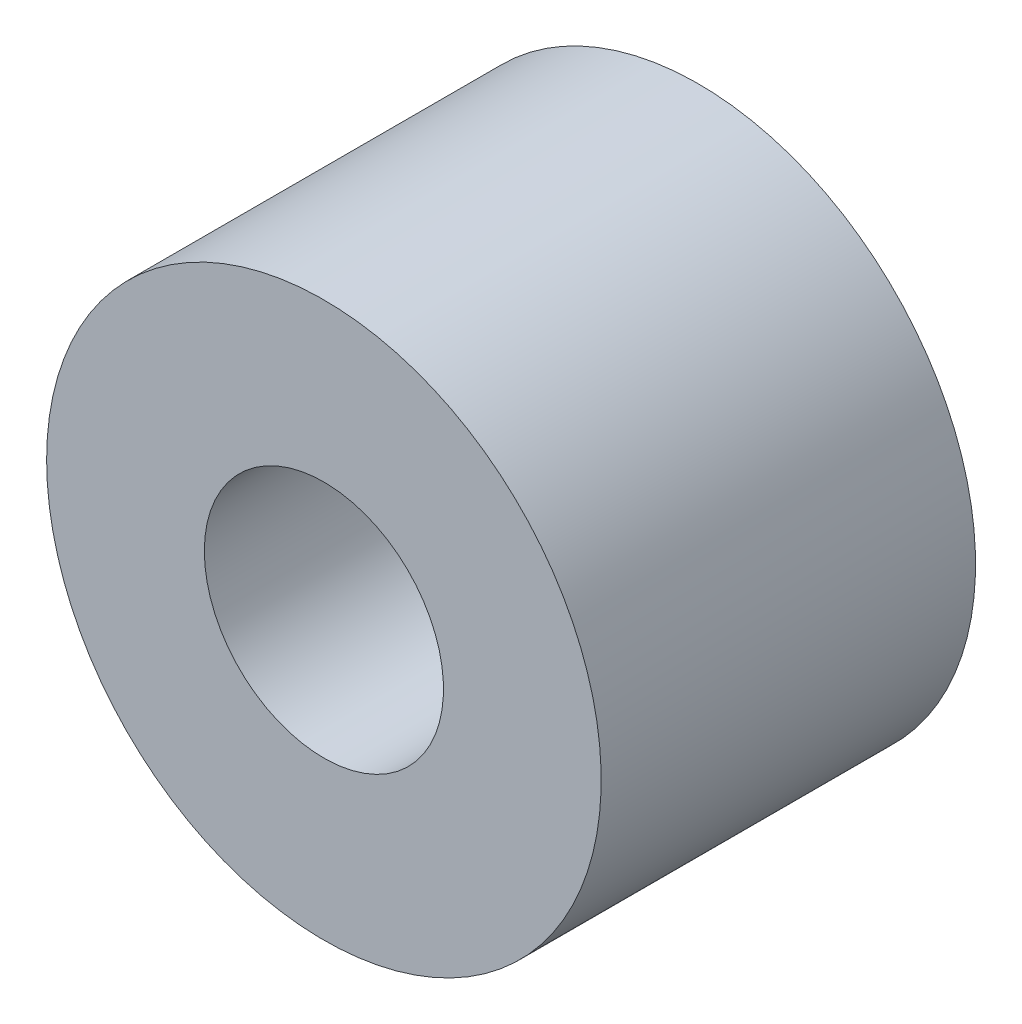
from build123d import *

# Parameters (mm, degrees)
SKETCH1_R           = 4
SKETCH1_R_2         = 1.725
BOSS_EXTRUDE1_DEPTH = 5.4


with BuildPart() as part:
    # Sketch1 → Boss-Extrude1 (new body)
    with BuildSketch(Plane.XY):
        with Locations(Location((0, 0, 0), (0, 0, 180))):
            Circle(SKETCH1_R)
        with Locations(Location((0, 0, 0), (0, 0, 180))):
            Circle(SKETCH1_R_2, mode=Mode.SUBTRACT)
    extrude(amount=BOSS_EXTRUDE1_DEPTH)


solid = part.part
